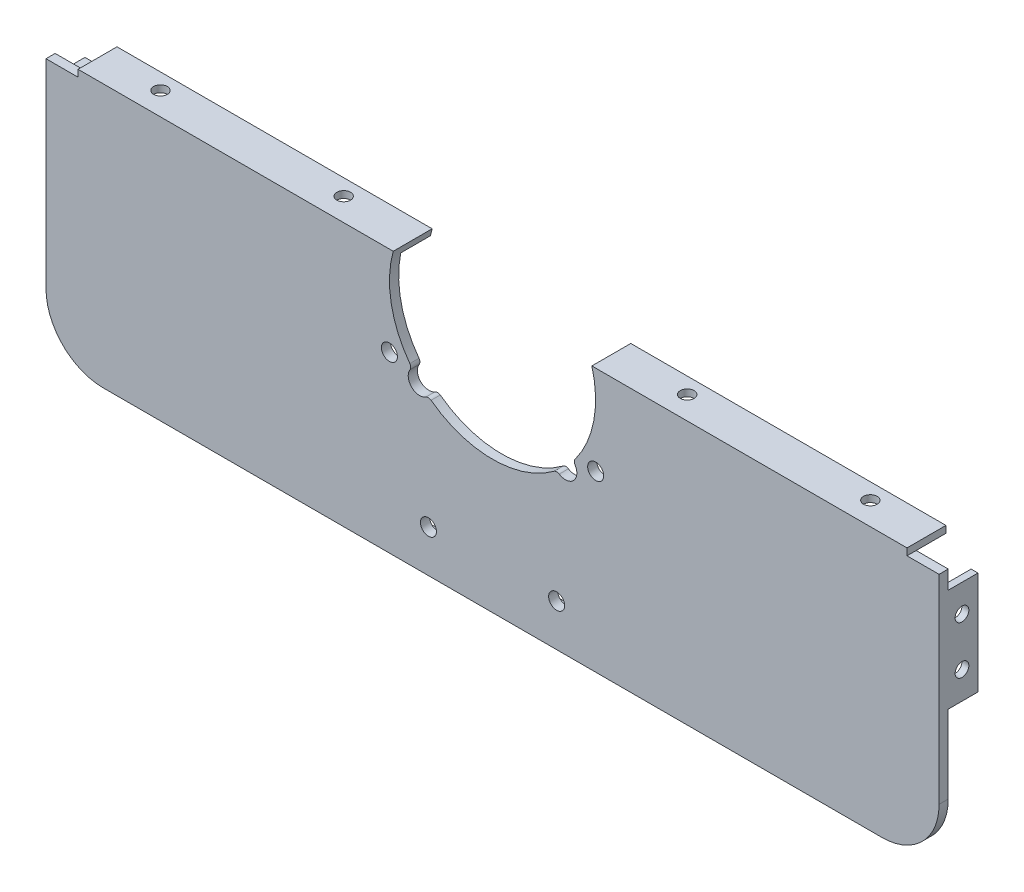
from build123d import *

# Parameters (mm, degrees)
EXTRUDE_1_DEPTH     = 4
SKETCH_5_W          = 390
SKETCH_5_H          = 17
EXTRUDE_2_DEPTH     = 3
SKETCH_7_R          = 3.5
CUT_EXTRUDE_1_DEPTH = 407.957000186
SKETCH_8_W          = 340
SKETCH_8_H          = 3
EXTRUDE_3_DEPTH     = 13
SKETCH_9_W          = 14
SKETCH_9_H          = 17
CUT_EXTRUDE_2_DEPTH = 3
SKETCH_18_W         = 3
SKETCH_18_H         = 45
EXTRUDE_4_DEPTH     = 13
SKETCH_19_R         = 3
CUT_EXTRUDE_3_DEPTH = 13
SKETCH_20_R         = 3
CUT_EXTRUDE_4_DEPTH = 407.809537745
SKETCH_22_R         = 3
CUT_EXTRUDE_5_DEPTH = 13


with BuildPart() as part:
    # 草图1 → 凸台-拉伸1 (new body)
    with BuildSketch(Plane.XY):
        with BuildLine():
            Line((0, 0), (390, 0))
            Line((390, 0), (390, -90))
            ThreePointArc((390, -90), (382.67766953, -107.67766953), (365, -115))
            Line((365, -115), (25, -115))
            ThreePointArc((25, -115), (7.32233047, -107.67766953), (0, -90))
            Line((0, -90), (0, 0))
        make_face()
    extrude(amount=EXTRUDE_1_DEPTH)

    # 草图5 → 凸台-拉伸2 (add)
    with BuildSketch(Plane(origin=(0, 0, 0), x_dir=(1, 0, 0), z_dir=(0, 1, 0))):
        with Locations((195, 4.5)):
            Rectangle(SKETCH_5_W, SKETCH_5_H)
    extrude(amount=-EXTRUDE_2_DEPTH)

    # 草图7 → 切除-拉伸1 (cut, through all)
    with BuildSketch(Plane.XY.offset(4)):
        with Locations((167, -96.601136347)):
            Circle(SKETCH_7_R)
        with Locations((149.963903366, -39)):
            Circle(SKETCH_7_R)
        with Locations(Location((223, -96.601136347, 0), (0, 0, 180))):
            Circle(SKETCH_7_R)
        with Locations(Location((240.036096634, -39, 0), (0, 0, 180))):
            Circle(SKETCH_7_R)
        with BuildLine():
            ThreePointArc((168.147738424, -48.1103316), (195, -57), (221.852261576, -48.1103316))
            ThreePointArc((221.852261576, -48.1103316), (222.97574381, -47.716458908), (224.124012489, -48.030826634))
            ThreePointArc((224.124012489, -48.030826634), (230.355339059, -47.355339059), (231.030826634, -41.124012489))
            ThreePointArc((231.030826634, -41.124012489), (230.716458908, -39.97574381), (231.1103316, -38.852261576))
            ThreePointArc((231.1103316, -38.852261576), (195, 33), (158.8896684, -38.852261576))
            ThreePointArc((158.8896684, -38.852261576), (159.283541092, -39.97574381), (158.969173366, -41.124012489))
            ThreePointArc((158.969173366, -41.124012489), (159.644660941, -47.355339059), (165.875987511, -48.030826634))
            ThreePointArc((165.875987511, -48.030826634), (167.02425619, -47.716458908), (168.147738424, -48.1103316))
        make_face()
    extrude(amount=-CUT_EXTRUDE_1_DEPTH, mode=Mode.SUBTRACT)

    # 草图8 → 凸台-拉伸3 (add)
    with BuildSketch(Plane(origin=(0, 0, 0), x_dir=(-1, 0, 0), z_dir=(0, 0, -1))):
        with Locations((-195, -113.5)):
            Rectangle(SKETCH_8_W, SKETCH_8_H)
    extrude(amount=EXTRUDE_3_DEPTH)

    # 草图9 → 切除-拉伸2 (cut)
    with BuildSketch(Plane(origin=(0, 0, 0), x_dir=(1, 0, 0), z_dir=(0, 1, 0))):
        with Locations((383, 4.5)):
            Rectangle(SKETCH_9_W, SKETCH_9_H)
        with Locations((7, 4.5)):
            Rectangle(SKETCH_9_W, SKETCH_9_H)
    extrude(amount=-CUT_EXTRUDE_2_DEPTH, mode=Mode.SUBTRACT)

    # 草图18 → 凸台-拉伸4 (add)
    with BuildSketch(Plane(origin=(0, 0, 0), x_dir=(-1, 0, 0), z_dir=(0, 0, -1))):
        with Locations((-388.5, -33.5)):
            Rectangle(SKETCH_18_W, SKETCH_18_H)
        with Locations((-1.5, -33.5)):
            Rectangle(SKETCH_18_W, SKETCH_18_H)
    extrude(amount=EXTRUDE_4_DEPTH)

    # 草图19 → 切除-拉伸3 (cut)
    with BuildSketch(Plane(origin=(0, 0, 0), x_dir=(1, 0, 0), z_dir=(0, 1, 0))):
        with Locations(Location((270, 6, 0), (0, 0, 270))):
            Circle(SKETCH_19_R)
        with Locations(Location((350, 6, 0), (0, 0, 270))):
            Circle(SKETCH_19_R)
        with Locations(Location((40, 6, 0), (0, 0, 270))):
            Circle(SKETCH_19_R)
        with Locations(Location((120, 6, 0), (0, 0, 270))):
            Circle(SKETCH_19_R)
    extrude(amount=-CUT_EXTRUDE_3_DEPTH, mode=Mode.SUBTRACT)

    # 草图20 → 切除-拉伸4 (cut, through all)
    with BuildSketch(Plane(origin=(390, 0, 0), x_dir=(0, 0, -1), z_dir=(1, 0, 0))):
        with Locations(Location((6, -23, 0), (0, 0, 270))):
            Circle(SKETCH_20_R)
        with Locations(Location((6, -44, 0), (0, 0, 90))):
            Circle(SKETCH_20_R)
    extrude(amount=-CUT_EXTRUDE_4_DEPTH, mode=Mode.SUBTRACT)

    # 草图22 → 切除-拉伸5 (cut)
    with BuildSketch(Plane.XZ.offset(115)):
        with Locations((75, -6)):
            Circle(SKETCH_22_R)
        with Locations((135, -6)):
            Circle(SKETCH_22_R)
        with Locations((315, -6)):
            Circle(SKETCH_22_R)
        with Locations((255, -6)):
            Circle(SKETCH_22_R)
    extrude(amount=-CUT_EXTRUDE_5_DEPTH, mode=Mode.SUBTRACT)


solid = part.part
